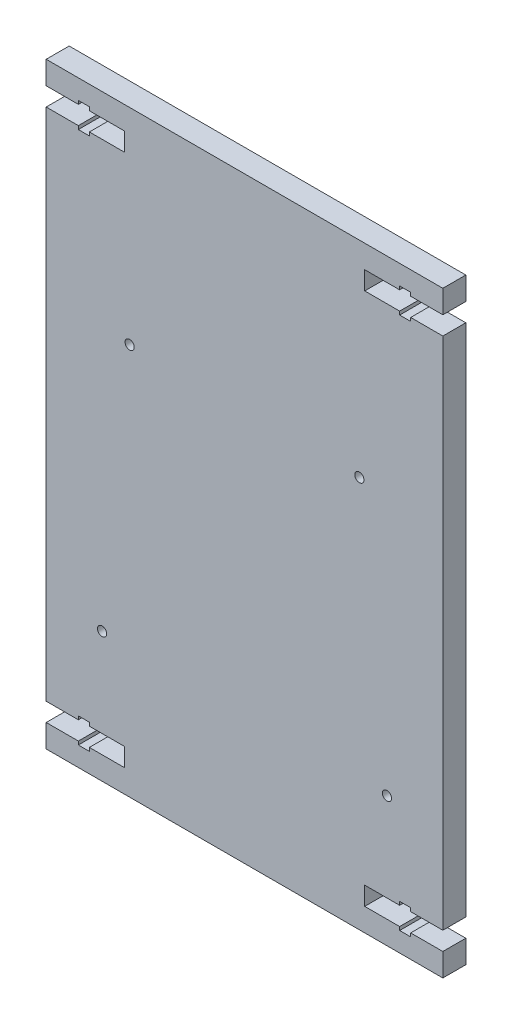
from build123d import *

# Parameters (mm, degrees)
SKETCH1_W           = 86.32648043
SKETCH1_H           = 130
BOSS_EXTRUDE1_DEPTH = 5
CUT_EXTRUDE2_DEPTH  = 10
SKETCH4_R           = 1
CUT_EXTRUDE3_DEPTH  = 10


with BuildPart() as part:
    # Sketch1 → Boss-Extrude1 (new body)
    with BuildSketch(Plane.XY):
        with Locations((9.075669342, 37.952105326)):
            Rectangle(SKETCH1_W, SKETCH1_H)
    extrude(amount=BOSS_EXTRUDE1_DEPTH)

    # Sketch3 → Cut-Extrude2 (cut)
    with BuildSketch(Plane.XY.offset(5)):
        Polygon((-34.087570873, -18.047894674), (-27.087570873, -18.047894674), (-27.087570873, -17.297894674), (-24.687570873, -17.297894674), (-24.687570873, -18.047894674), (-17.087570873, -18.047894674), (-17.087570873, -22.047894674), (-24.687570873, -22.047894674), (-24.687570873, -22.797894674), (-27.087570873, -22.797894674), (-27.087570873, -22.047894674), (-34.087570873, -22.047894674), align=None)
        Polygon((52.238909557, -18.047894674), (52.238909557, -22.047894674), (45.238909557, -22.047894674), (45.238909557, -22.797894674), (42.838909557, -22.797894674), (42.838909557, -22.047894674), (35.238909557, -22.047894674), (35.238909557, -18.047894674), (42.838909557, -18.047894674), (42.838909557, -17.297894674), (45.238909557, -17.297894674), (45.238909557, -18.047894674), align=None)
        Polygon((52.238909557, 93.952105326), (45.238909557, 93.952105326), (45.238909557, 93.202105326), (42.838909557, 93.202105326), (42.838909557, 93.952105326), (35.238909557, 93.952105326), (35.238909557, 97.952105326), (42.838909557, 97.952105326), (42.838909557, 98.702105326), (45.238909557, 98.702105326), (45.238909557, 97.952105326), (52.238909557, 97.952105326), align=None)
        Polygon((-34.087570873, 93.952105326), (-34.087570873, 97.952105326), (-27.087570873, 97.952105326), (-27.087570873, 98.702105326), (-24.687570873, 98.702105326), (-24.687570873, 97.952105326), (-17.087570873, 97.952105326), (-17.087570873, 93.952105326), (-24.687570873, 93.952105326), (-24.687570873, 93.202105326), (-27.087570873, 93.202105326), (-27.087570873, 93.952105326), align=None)
    extrude(amount=-CUT_EXTRUDE2_DEPTH, mode=Mode.SUBTRACT)

    # Sketch4 → Cut-Extrude3 (cut)
    with BuildSketch(Plane.XY.offset(5)):
        with Locations((40.075669342, 1.232918464)):
            Circle(SKETCH4_R)
        with Locations((-21.924330658, 1.232918464)):
            Circle(SKETCH4_R)
        with Locations((-15.924330658, 58.232918464)):
            Circle(SKETCH4_R)
        with Locations((34.075669342, 58.232918464)):
            Circle(SKETCH4_R)
    extrude(amount=-CUT_EXTRUDE3_DEPTH, mode=Mode.SUBTRACT)


solid = part.part
